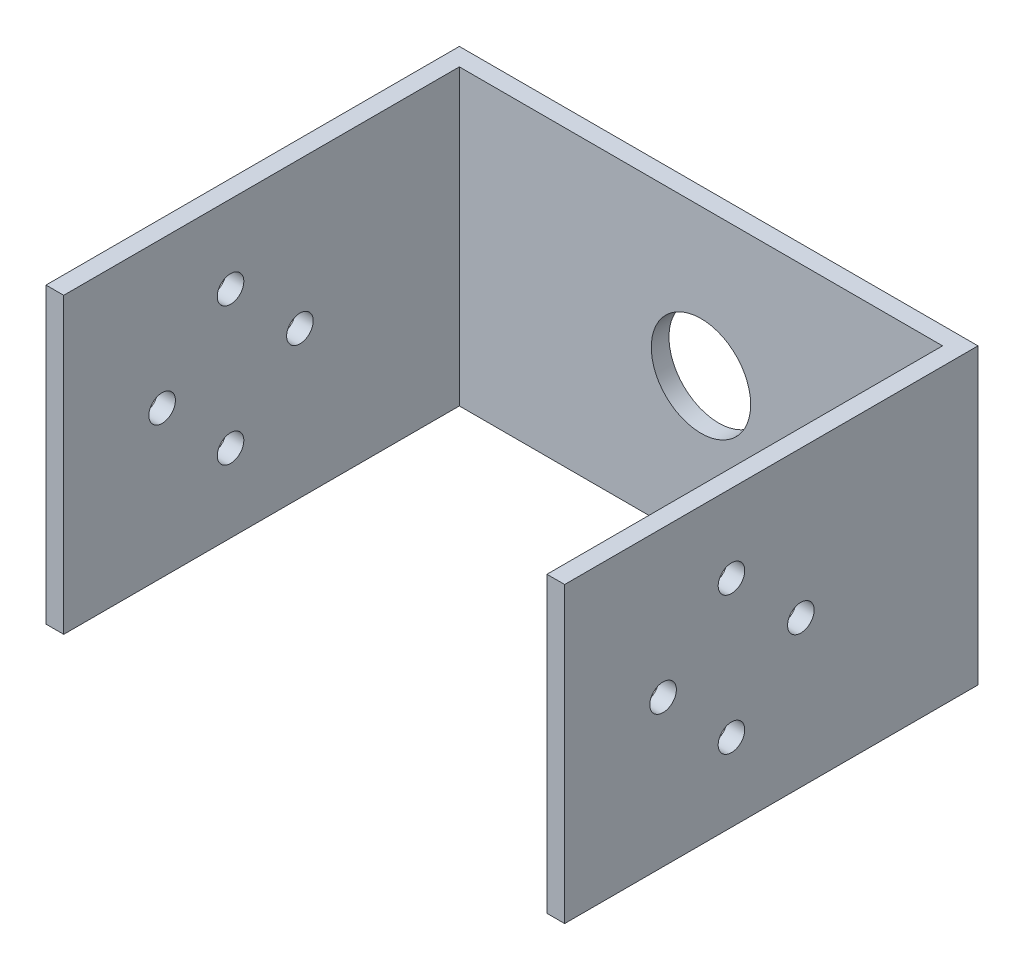
from build123d import *

# Parameters (mm, degrees)
ESBO_O1_W                = 49.1
ESBO_O1_H                = 29.84
ESBO_O1_R                = 5.05
RESSALTO_EXTRUS_O1_DEPTH = 1.8
ESBO_O2_W                = 42
ESBO_O2_H                = 29.84
ESBO_O2_R                = 1.35
RESSALTO_EXTRUS_O2_DEPTH = 1.8
RESSALTO_EXTRUS_O3_START = 1.8
ESBO_O3_W                = 42
ESBO_O3_H                = 29.84
ESBO_O3_R                = 1.35
RESSALTO_EXTRUS_O3_DEPTH = 1.8


with BuildPart() as part:
    # Esboço1 → Ressalto-extrusão1 (new body)
    with BuildSketch(Plane.XY):
        Rectangle(ESBO_O1_W, ESBO_O1_H)
        Circle(ESBO_O1_R, mode=Mode.SUBTRACT)
    extrude(amount=RESSALTO_EXTRUS_O1_DEPTH)

    # Esboço2 → Ressalto-extrusão2 (add)
    with BuildSketch(Plane.ZY.offset(24.55)):
        with Locations((21, 0)):
            Rectangle(ESBO_O2_W, ESBO_O2_H)
        with Locations((32, 0)):
            Circle(ESBO_O2_R, mode=Mode.SUBTRACT)
        with Locations((25.05, 7)):
            Circle(ESBO_O2_R, mode=Mode.SUBTRACT)
        with Locations(Location((18, 0, 0), (0, 0, 180))):
            Circle(ESBO_O2_R, mode=Mode.SUBTRACT)
        with Locations(Location((25.05, -7, 0), (0, 0, 180))):
            Circle(ESBO_O2_R, mode=Mode.SUBTRACT)
    extrude(amount=RESSALTO_EXTRUS_O2_DEPTH)

    # Esboço3 → Ressalto-extrusão3 (add)
    with BuildSketch(Plane(origin=(24.55, 0, 0), x_dir=(0, 0, -1), z_dir=(1, 0, 0)).offset(RESSALTO_EXTRUS_O3_START)):
        with Locations((-21, 0)):
            Rectangle(ESBO_O3_W, ESBO_O3_H)
        with Locations(Location((-25.05, 7, 0), (0, 0, 180))):
            Circle(ESBO_O3_R, mode=Mode.SUBTRACT)
        with Locations((-18, 0)):
            Circle(ESBO_O3_R, mode=Mode.SUBTRACT)
        with Locations(Location((-32, 0, 0), (0, 0, 180))):
            Circle(ESBO_O3_R, mode=Mode.SUBTRACT)
        with Locations((-25.05, -7)):
            Circle(ESBO_O3_R, mode=Mode.SUBTRACT)
    extrude(amount=-RESSALTO_EXTRUS_O3_DEPTH)


solid = part.part
